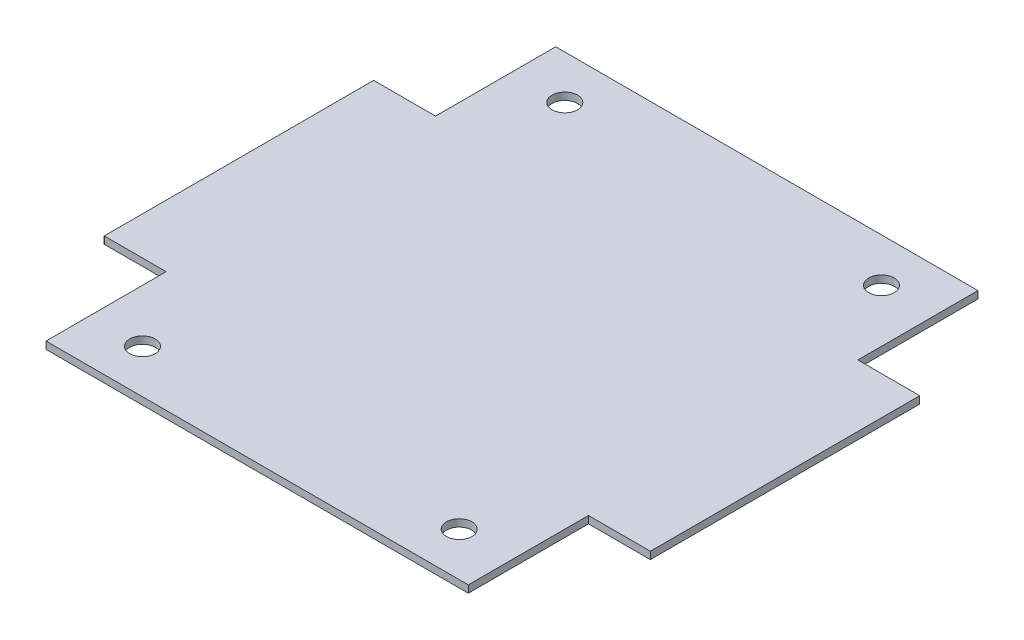
from build123d import *

# Parameters (mm, degrees)
EXTRUDE_1_DEPTH     = 1
SKETCH_2_R          = 1.75
CUT_EXTRUDE_1_DEPTH = 1


with BuildPart() as part:
    # Эскиз1 → Бобышка-Вытянуть1 (new body)
    with BuildSketch(Plane(origin=(0, 0, 0), x_dir=(1, 0, 0), z_dir=(0, 1, 0))):
        Polygon((-37.5, 18.5), (-29, 18.5), (-29, 35), (29, 35), (29, 18.5), (37.5, 18.5), (37.5, -18.5), (29, -18.5), (29, -35), (-29, -35), (-29, -18.5), (-37.5, -18.5), align=None)
    extrude(amount=EXTRUDE_1_DEPTH)

    # Эскиз2 → Вырез-Вытянуть1 (cut)
    with BuildSketch(Plane(origin=(0, 0, 0), x_dir=(1, 0, 0), z_dir=(0, 1, 0))):
        with Locations(Location((-21.75, 29, 0), (0, 0, 270))):
            Circle(SKETCH_2_R)
        with Locations(Location((21.75, 29, 0), (0, 0, 270))):
            Circle(SKETCH_2_R)
        with Locations(Location((21.75, -29, 0), (0, 0, 270))):
            Circle(SKETCH_2_R)
        with Locations(Location((-21.75, -29, 0), (0, 0, 270))):
            Circle(SKETCH_2_R)
    extrude(amount=CUT_EXTRUDE_1_DEPTH, mode=Mode.SUBTRACT)


solid = part.part
